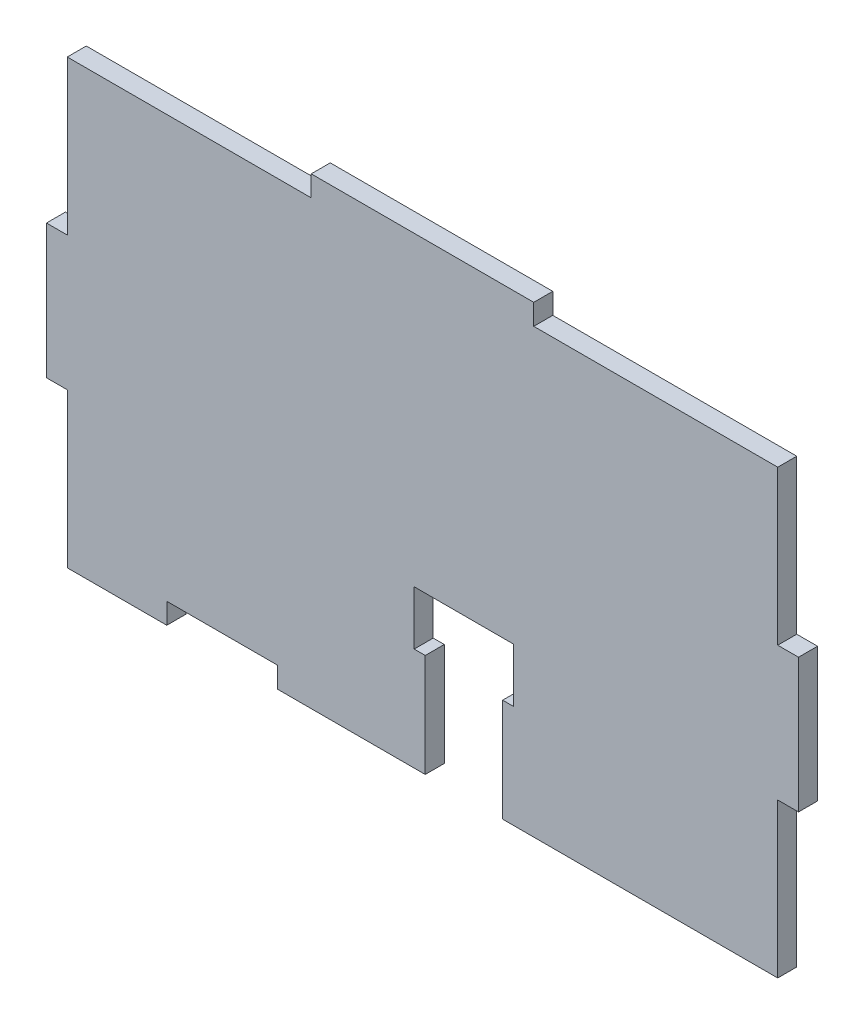
from build123d import *

# Parameters (mm, degrees)
BOSS_EXTRUDE1_DEPTH = 4.3


with BuildPart() as part:
    # Sketch1 → Boss-Extrude1 (new body)
    with BuildSketch(Plane.XY):
        Polygon((105.85, 0), (160.6, 0), (160.6, 34.85), (165.3, 34.85), (165.3, 65.15), (160.6, 65.15), (160.6, 100), (105.45, 100), (105.45, 104.7), (55.15, 104.7), (55.15, 100), (0, 100), (0, 65.15), (-4.7, 65.15), (-4.7, 34.85), (0, 34.85), (0, 0), (22.5, 0), (22.5, 4.7), (47.5, 4.7), (47.5, 0), (65.85, 0), (80.92, 0), (80.92, 23.3), (78.42, 23.3), (78.42, 35.5), (100.92, 35.5), (100.92, 23.3), (98.42, 23.3), (98.42, 0), align=None)
    extrude(amount=BOSS_EXTRUDE1_DEPTH)


solid = part.part
